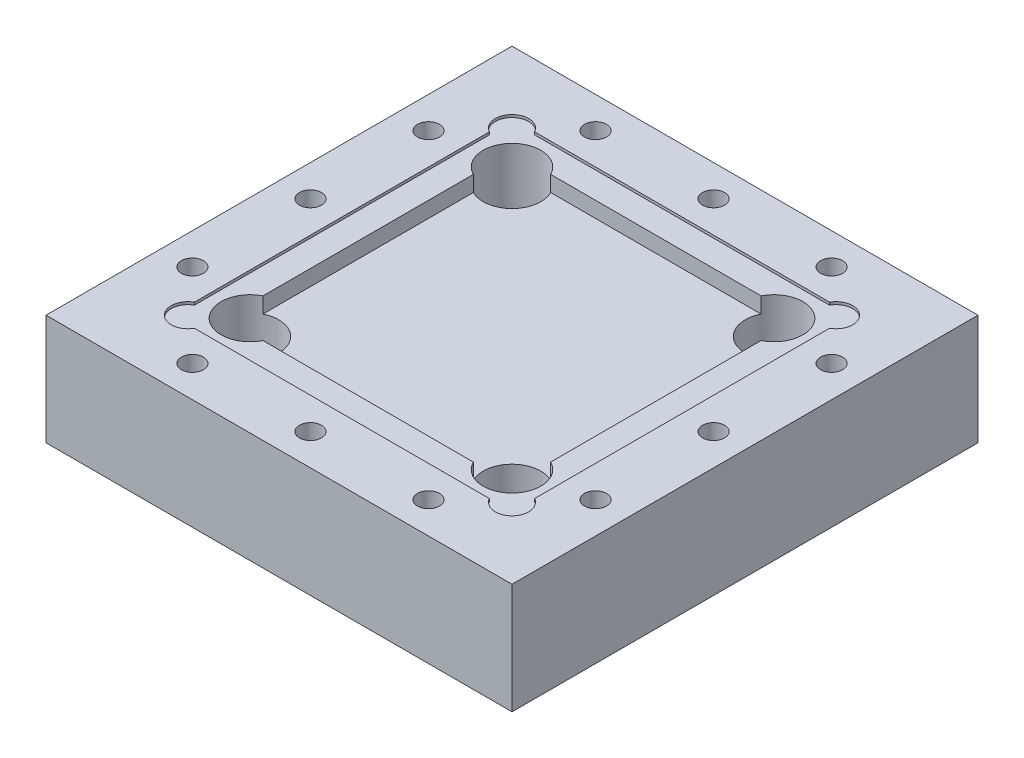
from build123d import *

# Parameters (mm, degrees)
SKETCH1_W                      = 88.9
SKETCH1_H                      = 88.9
BOSS_EXTRUDE1_DEPTH            = 21.082
CUT_EXTRUDE1_DEPTH             = 0.5
SKETCH3_W                      = 54.9
SKETCH3_H                      = 54.9
CUT_EXTRUDE2_DEPTH             = 3
FILLET1_R                      = 6.35
CBORE_FOR_M6_SHCS1_D           = 6.6
CBORE_FOR_M6_SHCS1_CBORE_D     = 11
CBORE_FOR_M6_SHCS1_CBORE_DEPTH = 14.7376
M5X0_8_TAPPED_HOLE1_D          = 4.2


with BuildPart() as part:
    # Sketch1 → Boss-Extrude1 (new body)
    with BuildSketch(Plane(origin=(0, 0, 0), x_dir=(1, 0, 0), z_dir=(0, 1, 0))):
        Rectangle(SKETCH1_W, SKETCH1_H)
    extrude(amount=BOSS_EXTRUDE1_DEPTH)

    # Sketch2 → Cut-Extrude1 (cut)
    with BuildSketch(Plane(origin=(0, 21.082, 0), x_dir=(1, 0, 0), z_dir=(0, 1, 0))):
        with BuildLine():
            Line((28.134397615, -32.45), (-28.134397615, -32.45))
            ThreePointArc((-28.134397615, -32.45), (-33.157106781, -33.157106781), (-32.45, -28.134397615))
            Line((-32.45, -28.134397615), (-32.45, 28.134397615))
            ThreePointArc((-32.45, 28.134397615), (-33.157106781, 33.157106781), (-28.134397615, 32.45))
            Line((-28.134397615, 32.45), (28.134397615, 32.45))
            ThreePointArc((28.134397615, 32.45), (33.157106781, 33.157106781), (32.45, 28.134397615))
            Line((32.45, 28.134397615), (32.45, -28.134397615))
            ThreePointArc((32.45, -28.134397615), (33.157106781, -33.157106781), (28.134397615, -32.45))
        make_face()
    extrude(amount=-CUT_EXTRUDE1_DEPTH, mode=Mode.SUBTRACT)

    # Sketch3 → Cut-Extrude2 (cut)
    with BuildSketch(Plane(origin=(0, 20.582, 0), x_dir=(1, 0, 0), z_dir=(0, 1, 0))):
        Rectangle(SKETCH3_W, SKETCH3_H)
    extrude(amount=-CUT_EXTRUDE2_DEPTH, mode=Mode.SUBTRACT)

    # Fillet1
    fillet1_edges = [part.edges().sort_by_distance(p)[0] for p in [
        (27.45, 19.082, 27.45),
        (-27.45, 19.082, 27.45),
        (-27.45, 19.082, -27.45),
        (27.45, 19.082, -27.45),
    ]]
    fillet(fillet1_edges, radius=FILLET1_R)

    # CBORE for M6 SHCS1 (through all)
    with Locations(Plane(origin=(0, 21.082, 0), x_dir=(1, 0, 0), z_dir=(0, 1, 0))):
        with Locations((-25, 25), (25, 25), (25, -25), (-25, -25)):
            CounterBoreHole(CBORE_FOR_M6_SHCS1_D / 2, CBORE_FOR_M6_SHCS1_CBORE_D / 2, CBORE_FOR_M6_SHCS1_CBORE_DEPTH)

    # M5x0.8 Tapped Hole1 (through all)
    with Locations(Plane(origin=(0, 21.082, 0), x_dir=(1, 0, 0), z_dir=(0, 1, 0))):
        with Locations((-38.45, 22.523488527), (-38.45, 0), (-38.45, -22.523488527), (-22.523488527, -38.45), (0, -38.45), (22.523488527, -38.45), (38.45, -22.523488527), (38.45, 0), (38.45, 22.523488527), (22.523488527, 38.45), (0, 38.45), (-22.523488527, 38.45)):
            Hole(M5X0_8_TAPPED_HOLE1_D / 2)


solid = part.part
